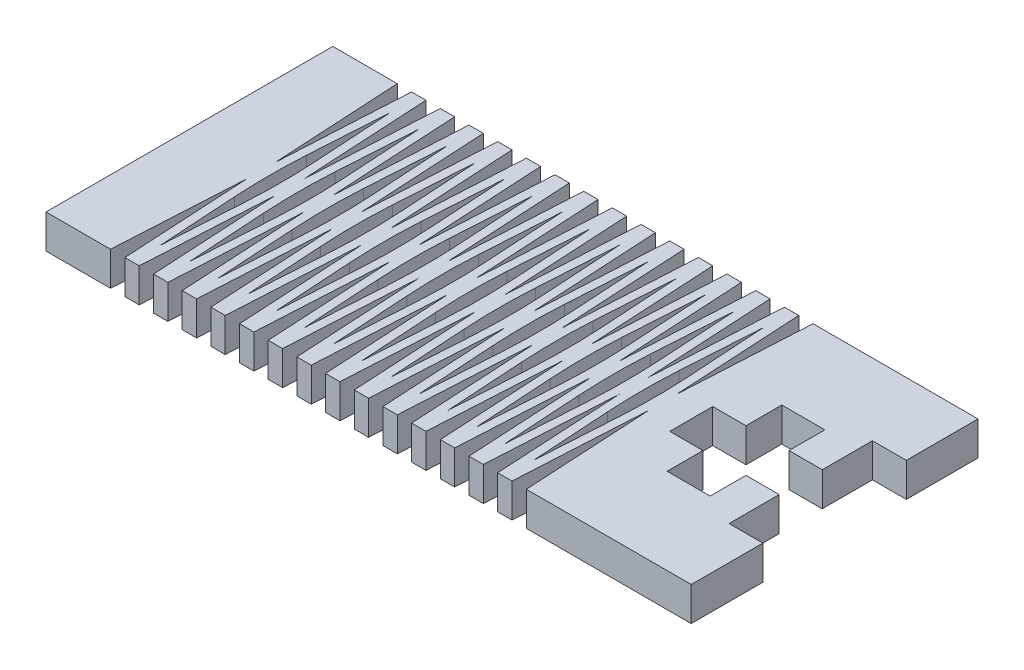
from build123d import *

# Parameters (mm, degrees)
BOSS_EXTRUDE1_DEPTH = 3
CUT_EXTRUDE2_DEPTH  = 32.413701231
LPATTERN1_COUNT     = 15
LPATTERN1_PITCH     = 2.54
CUT_EXTRUDE3_DEPTH  = 32.413701231
LPATTERN3_COUNT     = 14
LPATTERN3_PITCH     = 2.54


with BuildPart() as part:
    # Sketch1 → Boss-Extrude1 (new body)
    with BuildSketch(Plane(origin=(0, 0, 0), x_dir=(1, 0, 0), z_dir=(0, 1, 0))):
        Polygon((28.575, 6.35), (25.575, 6.35), (25.575, 1.905), (22.63, 1.905), (22.63, 5.08), (18.82, 5.08), (18.82, 1.905), (15.875, 1.905), (15.875, -1.905), (18.82, -1.905), (18.82, -5.08), (22.63, -5.08), (22.63, -1.905), (25.575, -1.905), (25.575, -6.35), (28.575, -6.35), (28.575, -12.7), (-28.575, -12.7), (-28.575, 12.7), (28.575, 12.7), align=None)
    extrude(amount=BOSS_EXTRUDE1_DEPTH)

    # Sketch3 → Cut-Extrude2 (cut, through all)
    with BuildSketch(Plane(origin=(0, 3, 0), x_dir=(1, 0, 0), z_dir=(0, 1, 0))):
        Polygon((13.97, 12.7), (13.335, 1.27), (12.7, 12.7), align=None)
        Polygon((12.7, -12.7), (13.97, -12.7), (13.335, -1.27), align=None)
    cut_extrude2 = extrude(amount=-CUT_EXTRUDE2_DEPTH, mode=Mode.SUBTRACT)

    # LPattern1: Cut-Extrude2 ×15
    with Locations(*[(-i * LPATTERN1_PITCH, 0, 0) for i in range(1, LPATTERN1_COUNT)]):
        add(cut_extrude2, mode=Mode.SUBTRACT)

    # Sketch4 → Cut-Extrude3 (cut, through all)
    with BuildSketch(Plane(origin=(0, 3, 0), x_dir=(1, 0, 0), z_dir=(0, 1, 0))):
        with BuildLine():
            Line((12.065, 10.16), (12.501948941, 3.168816937))
            ThreePointArc((12.501948941, 3.168816937), (12.600877955, 0), (12.501948941, -3.168816937))
            Line((12.501948941, -3.168816937), (12.065, -10.16))
            Line((12.065, -10.16), (11.628051059, -3.168816937))
            ThreePointArc((11.628051059, -3.168816937), (11.529122045, 0), (11.628051059, 3.168816937))
            Line((11.628051059, 3.168816937), (12.065, 10.16))
        make_face()
    cut_extrude3 = extrude(amount=-CUT_EXTRUDE3_DEPTH, mode=Mode.SUBTRACT)

    # LPattern3: Cut-Extrude3 ×14
    with Locations(*[(-i * LPATTERN3_PITCH, 0, 0) for i in range(1, LPATTERN3_COUNT)]):
        add(cut_extrude3, mode=Mode.SUBTRACT)


solid = part.part
